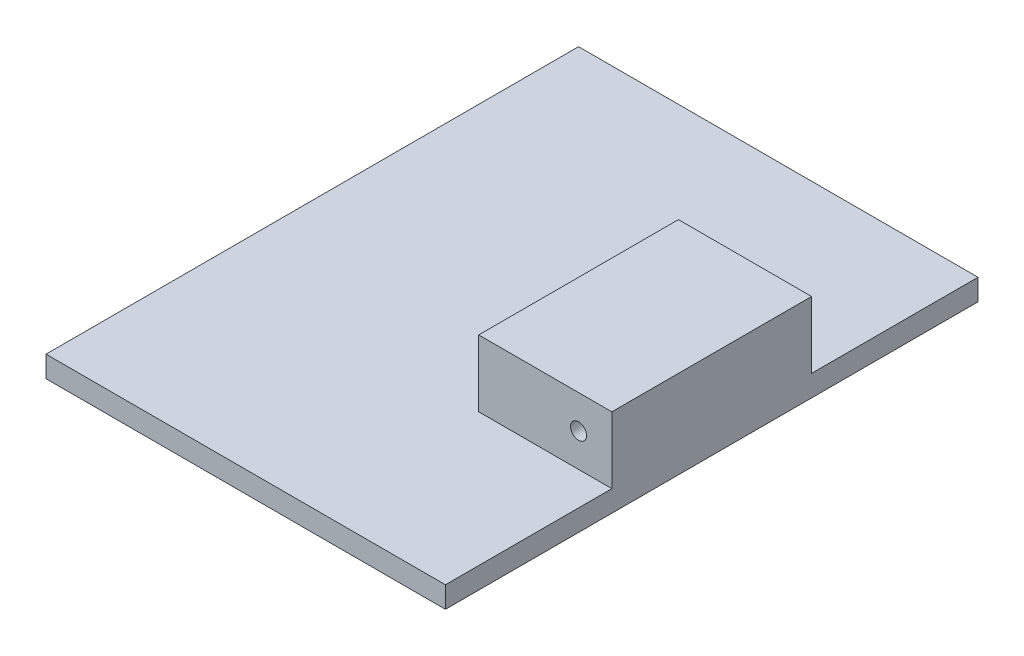
from build123d import *

# Parameters (mm, degrees)
SKETCH1_W               = 300
SKETCH1_H               = 400
BOSS_EXTRUDE1_DEPTH     = 16
SKETCH2_W               = 100
SKETCH2_H               = 150
BOSS_EXTRUDE2_DEPTH     = 50
CUT_EXTRUDE1_DEPTH      = 321.126537482
CUT_EXTRUDE1_DEPTH_BACK = 321.126537482
SKETCH3_R               = 6


with BuildPart() as part:
    # Sketch1 → Boss-Extrude1 (new body)
    with BuildSketch(Plane(origin=(0, 0, 0), x_dir=(1, 0, 0), z_dir=(0, 1, 0))):
        Rectangle(SKETCH1_W, SKETCH1_H)
    extrude(amount=BOSS_EXTRUDE1_DEPTH)

    # Sketch2 → Boss-Extrude2 (add)
    with BuildSketch(Plane(origin=(0, 16, 0), x_dir=(1, 0, 0), z_dir=(0, 1, 0))):
        with Locations((100, 0)):
            Rectangle(SKETCH2_W, SKETCH2_H)
    extrude(amount=BOSS_EXTRUDE2_DEPTH)

    # Sketch3 → Cut-Extrude1 (cut, two sides: drawn at the far end of the back side and taken through both)
    with BuildSketch(Plane(origin=(0, 0, -75), x_dir=(-1, 0, 0), z_dir=(0, 0, -1)).offset(-CUT_EXTRUDE1_DEPTH_BACK)):
        with Locations((-125, 41)):
            Circle(SKETCH3_R)
    extrude(amount=CUT_EXTRUDE1_DEPTH + CUT_EXTRUDE1_DEPTH_BACK, mode=Mode.SUBTRACT)


solid = part.part
